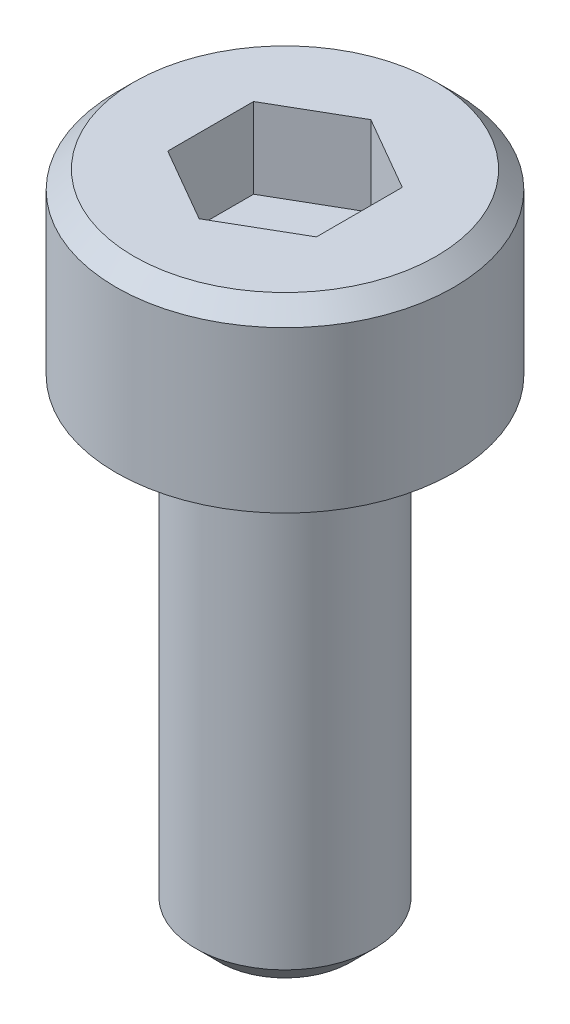
from build123d import *

# Parameters (mm, degrees)
CUT_EXTRUDE1_DEPTH = 1.35


with BuildPart() as part:
    # Sketch1 → Revolve1 (revolve)
    with BuildSketch(Plane.XY, mode=Mode.PRIVATE) as revolve1_sk:
        Polygon((0, -8), (1.1, -8), (1.5, -7.6), (1.5, 0), (2.84, 0), (2.84, 2.7), (2.54, 3), (0, 3), align=None)
    revolve(revolve1_sk.sketch.rotate(Axis((0, -10, 0), (0, 1, 0)), 90), axis=Axis((0, -10, 0), (0, 1, 0)))

    # Sketch2 → Cut-Extrude1 (cut)
    with BuildSketch(Plane(origin=(0, 3, 0), x_dir=(1, 0, 0), z_dir=(0, 1, 0))):
        Polygon((1.25, -0.721687836), (0, -1.443375673), (-1.25, -0.721687836), (-1.25, 0.721687836), (0, 1.443375673), (1.25, 0.721687836), align=None)
    extrude(amount=-CUT_EXTRUDE1_DEPTH, mode=Mode.SUBTRACT)


solid = part.part
